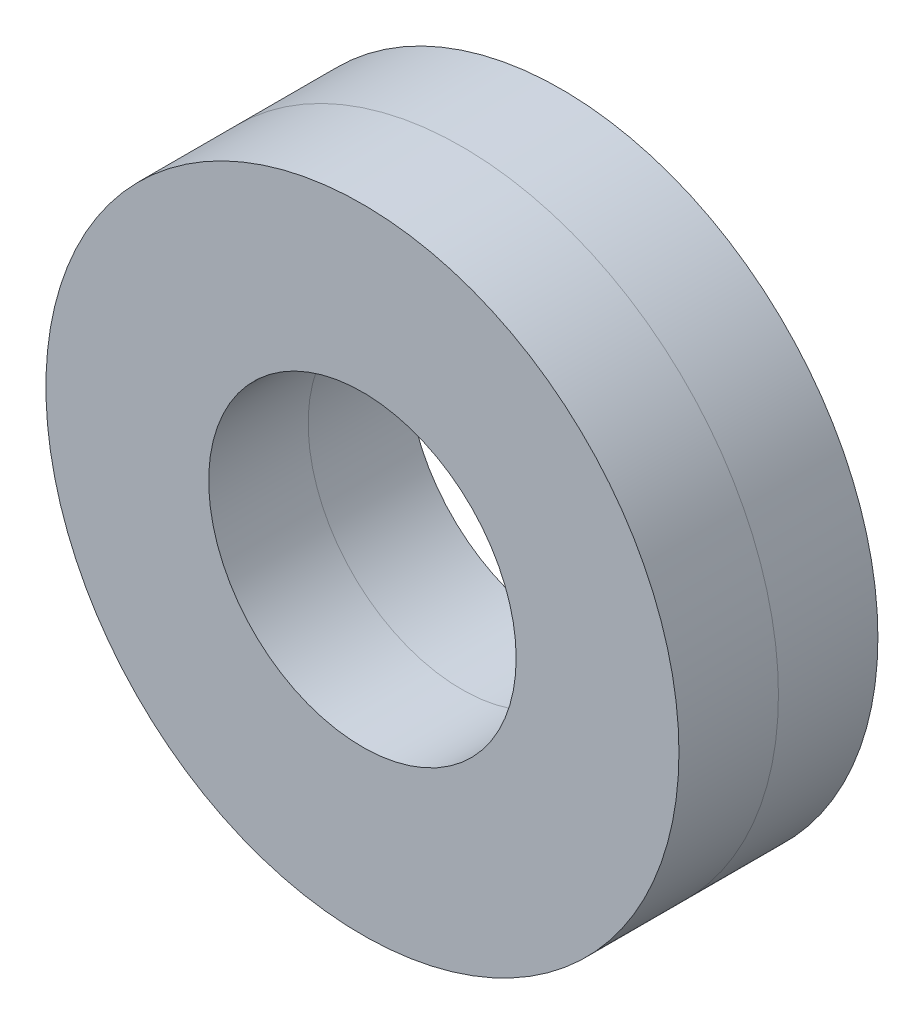
from build123d import *

# Parameters (mm, degrees)
SKETCH_8_W   = 1.1
SKETCH_8_H   = 1.8
SKETCH_8_8_W = 1.1
SKETCH_8_8_H = 1.8


with BuildPart() as part:
    # 草图8 → 旋转3 (revolve)
    with BuildSketch(Plane(origin=(0, 0, 0), x_dir=(0, 0, -1), z_dir=(1, 0, 0))):
        with Locations((-0.55, 2.6)):
            Rectangle(SKETCH_8_W, SKETCH_8_H)
    revolve(axis=Axis((0, 0, 0), (0, 0, -1)))


with BuildPart() as body_2:
    # 草图8<8> → 旋转4 (revolve)
    with BuildSketch(Plane(origin=(0, 0, 0), x_dir=(0, 0, -1), z_dir=(1, 0, 0))):
        with Locations((0.55, 2.6)):
            Rectangle(SKETCH_8_8_W, SKETCH_8_8_H)
    revolve(axis=Axis((0, 0, 0), (0, 0, -1)))


solid = Compound([part.part, body_2.part])
